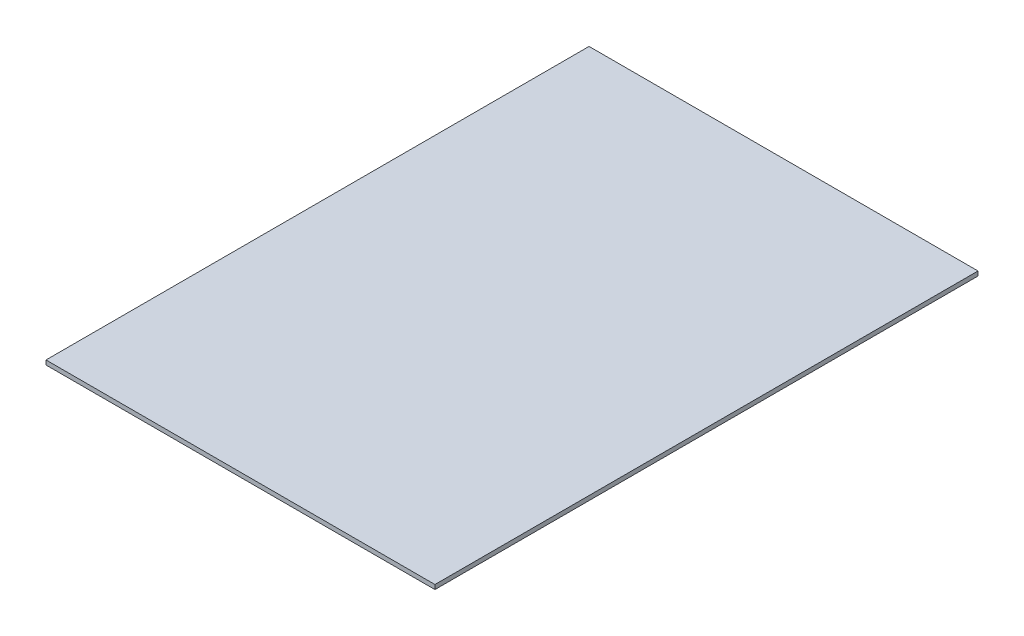
from build123d import *

# Parameters (mm, degrees)
SKETCH1_W           = 420.6875
SKETCH1_H           = 587.375
BOSS_EXTRUDE1_DEPTH = 4.7625


with BuildPart() as part:
    # Sketch1 → Boss-Extrude1 (new body)
    with BuildSketch(Plane(origin=(0, 0, 0), x_dir=(1, 0, 0), z_dir=(0, 1, 0))):
        with Locations((210.34375, 293.6875)):
            Rectangle(SKETCH1_W, SKETCH1_H)
    extrude(amount=BOSS_EXTRUDE1_DEPTH)


solid = part.part
